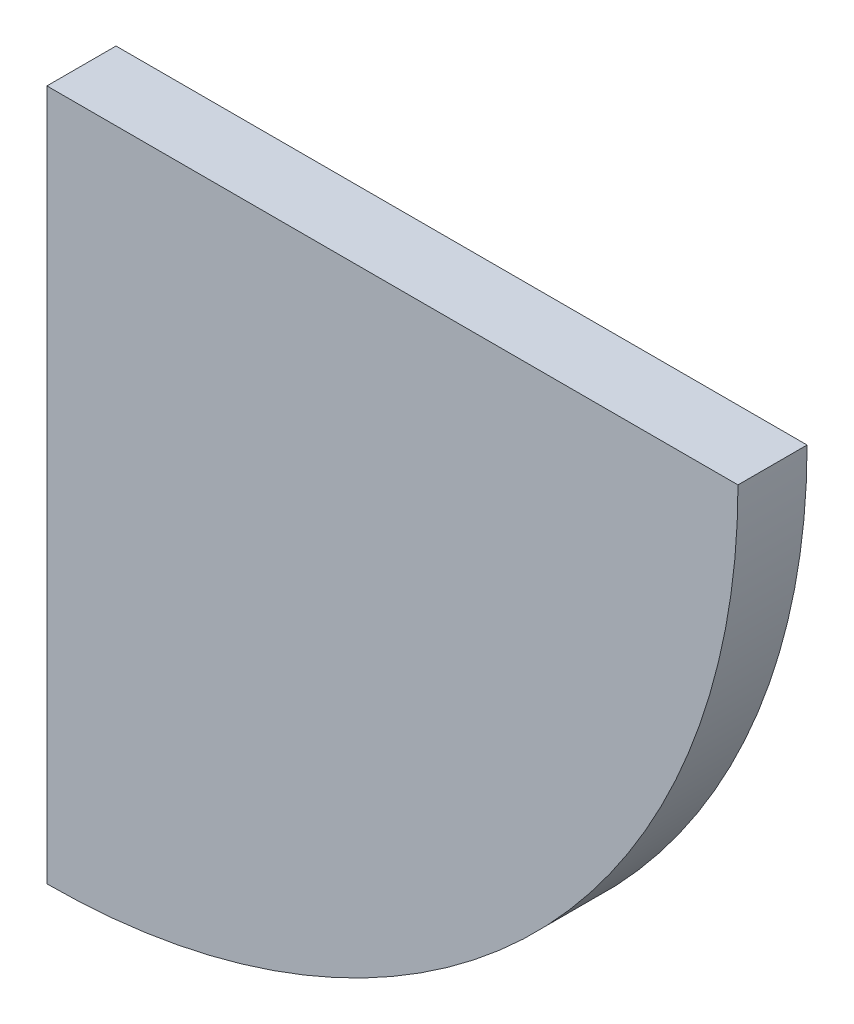
from build123d import *

# Parameters (mm, degrees)
THICKEN2_T1 = 20


with BuildPart() as body_1:
    # Sketch1 → Surface-Plane1: a flat surface bounded by the sketch
    with BuildSketch(Plane.XY, mode=Mode.PRIVATE) as surface_plane1_1_region:
        with BuildLine():
            Line((0, -200), (0, 0))
            Line((0, 0), (200, 0))
            ThreePointArc((200, 0), (141.421356237, -141.421356237), (0, -200))
        make_face()
    surface_plane1_1 = surface_plane1_1_region.sketch.faces()[0]
    add(Solid.thicken(surface_plane1_1, THICKEN2_T1))


solid = body_1.part
